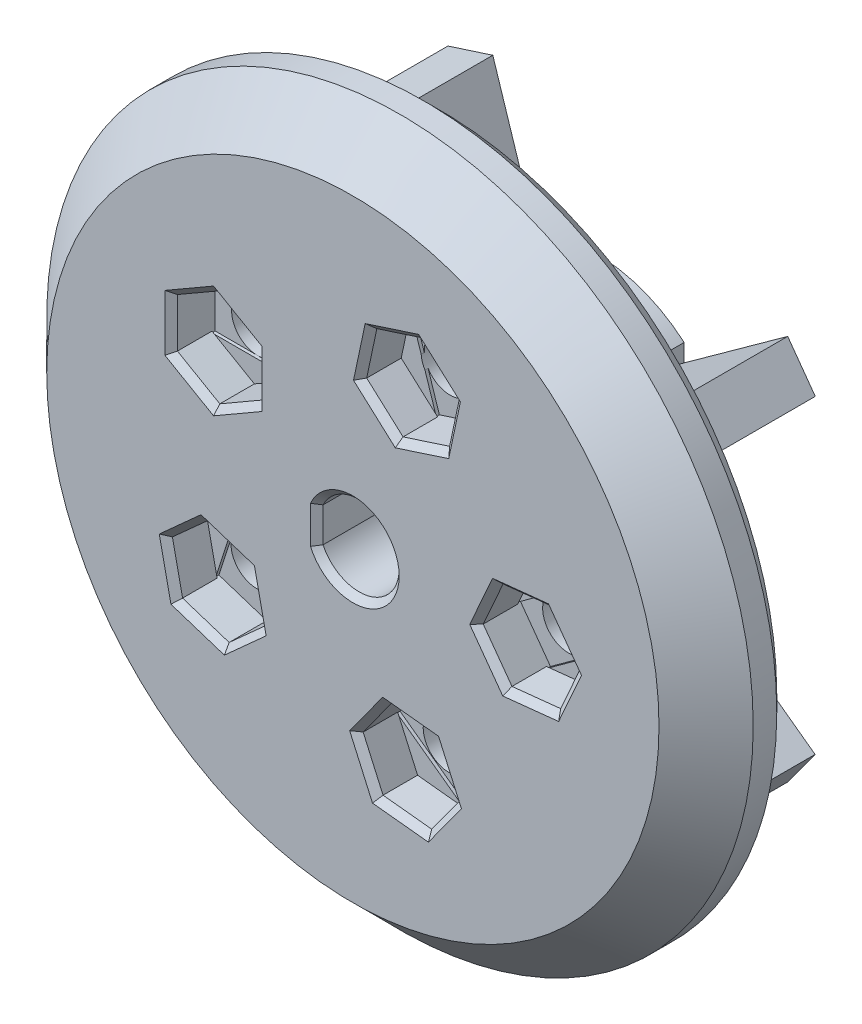
from build123d import *
from build123d.topology import SkipClean

# Parameters (mm, degrees)
SKETCH1_R               = 22.5
BOSS_EXTRUDE1_DEPTH     = 5.5
SKETCH2_R               = 1.524999999999999
SKETCH2_R_2             = 1.5250000000000004
SKETCH2_R_3             = 1.5250000000000008
CUT_EXTRUDE1_DEPTH      = 3.5
CUT_EXTRUDE2_DEPTH      = 33.29163978493505
CUT_EXTRUDE2_DEPTH_BACK = 33.29163978493505
SKETCH3_R               = 2.5500000000000003
SKETCH3_R_2             = 1.6500000000000006
SKETCH3_R_3             = 1.6500000000000001
SKETCH3_R_4             = 1.6500000000000004
BOSS_EXTRUDE2_START     = 10
SKETCH4_R               = 8.550000000000002
SKETCH4_R_2             = 2.5500000000000003
BOSS_EXTRUDE2_DEPTH     = 10
BOSS_EXTRUDE3_DEPTH     = 15.5
CUT_EXTRUDE3_DEPTH      = 10
SKETCH5_R               = 1.5000000000000004
CUT_EXTRUDE4_DEPTH      = 8
CHAMFER7_SIZE           = 1
CHAMFER8_SIZE           = 3
CUT_EXTRUDE5_DEPTH      = 2.2
CORTAR_EXTRUIR1_DEPTH   = 2.6
CROQUIS2_W              = 5.399999999999998
CROQUIS2_H              = 3.3
CORTAR_EXTRUIR2_DEPTH   = 0.2
MATRIZC1_COUNT          = 5
CHAFL_N1_SIZE           = 0.4
SALIENTE_EXTRUIR1_REACH = 35.354
CORTAR_EXTRUIR3_DEPTH   = 7.8
SALIENTE_EXTRUIR2_START = -2.2
SALIENTE_EXTRUIR2_DEPTH = 7.8
REDONDEO1_R             = 7
CORTAR_EXTRUIR4_START   = -30.200000000000003
CROQUIS6_R              = 1.5000000000000004
CORTAR_EXTRUIR4_DEPTH   = 30.200000000000003
CHAFL_N2_SIZE           = 0.4


with BuildPart() as part:
    # Sketch1 → Boss-Extrude1 (new body)
    with BuildSketch(Plane.XY):
        Circle(SKETCH1_R)
        with BuildLine():
            ThreePointArc((-1.7397196261682235, -1.8643700336373934), (2.55, 0), (-1.7397196261682235, 1.8643700336373934))
            ThreePointArc((-1.7397196261682235, 1.8643700336373934), (-2.55, 3.1e-16), (-1.7397196261682235, -1.8643700336373934))
        make_face(mode=Mode.SUBTRACT)
    extrude(amount=BOSS_EXTRUDE1_DEPTH)

    # Sketch2 → Cut-Extrude1 (cut)
    with BuildSketch(Plane(origin=(0, 0, 0), x_dir=(-1, 0, 0), z_dir=(0, 0, -1))):
        with Locations((-18.850000000000005, -2.51e-15)):
            Circle(SKETCH2_R)
        with Locations((-5.824970343967765, 17.92741533216365)):
            Circle(SKETCH2_R_2)
        with Locations((15.24997034396776, 11.079752005713127)):
            Circle(SKETCH2_R_3)
        with Locations((15.249970343967767, -11.079752005713122)):
            Circle(SKETCH2_R_3)
        with Locations((-5.824970343967754, -17.92741533216365)):
            Circle(SKETCH2_R_2)
    extrude(amount=-CUT_EXTRUDE1_DEPTH, mode=Mode.SUBTRACT)

    # Sketch3 → Cut-Extrude2 (cut, two sides: drawn at the far end of the back side and taken through both)
    with BuildSketch(Plane(origin=(0, 0, 0), x_dir=(-1, 0, 0), z_dir=(0, 0, -1)).offset(-CUT_EXTRUDE2_DEPTH_BACK)):
        with Locations(Location((0, 0, 0), (0, 0, 180))):
            Circle(SKETCH3_R)
        with Locations((-10.937500000000004, 0)):
            Circle(SKETCH3_R_2)
        with Locations((-3.3953242256948823, 10.449733472793108)):
            Circle(SKETCH3_R_3)
        with Locations((8.873623375975901, 6.50584328537859)):
            Circle(SKETCH3_R_2)
        with Locations((8.914074225694833, -6.381348371133892)):
            Circle(SKETCH3_R_2)
        with Locations((-3.329873375975839, -10.402180646978138)):
            Circle(SKETCH3_R_4)
    extrude(amount=CUT_EXTRUDE2_DEPTH + CUT_EXTRUDE2_DEPTH_BACK, mode=Mode.SUBTRACT)

    # Sketch4 → Boss-Extrude2 (add)
    with SkipClean():  # the faces are left unmerged after this step: merging them gives an invalid solid
        with BuildSketch(Plane(origin=(0, 0, 0), x_dir=(-1, 0, 0), z_dir=(0, 0, -1)).offset(BOSS_EXTRUDE2_START)):
            with Locations(Location((0, 0, 0), (0, 0, 180))):
                Circle(SKETCH4_R)
            Circle(SKETCH4_R_2, mode=Mode.SUBTRACT)
        extrude(amount=-BOSS_EXTRUDE2_DEPTH)

    # Sketch8 → Boss-Extrude3 (add)
    with BuildSketch(Plane(origin=(0, 0, -10), x_dir=(-1, 0, 0), z_dir=(0, 0, -1))):
        with BuildLine():
            Line((2.2999999999999994, 1.101135777277262), (2.2999999999999994, -1.101135777277262))
            ThreePointArc((2.2999999999999994, -1.101135777277262), (2.5499999999999994, 0), (2.2999999999999994, 1.101135777277262))
        make_face()
    extrude(amount=-BOSS_EXTRUDE3_DEPTH)

    # Sketch6 → Cut-Extrude3 (cut)
    with BuildSketch(Plane(origin=(0, 0, -10), x_dir=(-1, 0, 0), z_dir=(0, 0, -1))):
        Polygon((4.799999999999999, -2.8), (7.299999999999999, -2.8), (7.299999999999998, 2.8000000000000007), (4.799999999999998, 2.8), align=None)
    extrude(amount=-CUT_EXTRUDE3_DEPTH, mode=Mode.SUBTRACT)

    # Sketch5 → Cut-Extrude4 (cut)
    with BuildSketch(Plane.ZY.offset(8.55)):
        with Locations(Location((-4.2, -5.1e-16, 0), (0, 0, 47.230421849))):
            Circle(SKETCH5_R)
    extrude(amount=-CUT_EXTRUDE4_DEPTH, mode=Mode.SUBTRACT)

    # Chamfer7
    chamfer7_edges = [part.edges().sort_by_distance(p)[0] for p in [
        (-22.5, 2.76e-15, 0),
    ]]
    chamfer(chamfer7_edges, length=CHAMFER7_SIZE)

    # Chamfer8
    chamfer8_edges = [part.edges().sort_by_distance(p)[0] for p in [
        (-22.5, 2.76e-15, 5.5),
    ]]
    chamfer(chamfer8_edges, length=CHAMFER8_SIZE)

    # Sketch7 → Cut-Extrude5 (cut)
    with BuildSketch(Plane(origin=(0, 0, -10), x_dir=(-1, 0, 0), z_dir=(0, 0, -1))):
        with BuildLine():
            Line((-5.6, -6.460843598168895), (-5.6, 6.460843598168895))
            ThreePointArc((-5.6, 6.460843598168895), (-8.549999999999999, 1.05e-15), (-5.6, -6.460843598168895))
        make_face()
    extrude(amount=-CUT_EXTRUDE5_DEPTH, mode=Mode.SUBTRACT)

    # Croquis1 → Cortar-Extruir1 (cut)
    with BuildSketch(Plane.XY.offset(5.5)):
        Polygon((-8.873623375975903, 3.388151831754609), (-6.173623375975903, 4.9469975585666), (-6.173623375975902, 8.064689012190575), (-8.873623375975901, 9.623534739002565), (-11.5736233759759, 8.064689012190577), (-11.5736233759759, 4.946997558566598), align=None)
    cortar_extruir1 = extrude(amount=-CORTAR_EXTRUIR1_DEPTH, mode=Mode.SUBTRACT)

    # Croquis2 → Cortar-Extruir2 (cut)
    with BuildSketch(Plane.XY.offset(2.9)):
        with Locations((-8.873623375975901, 6.505843285378589)):
            Rectangle(CROQUIS2_W, CROQUIS2_H)
    cortar_extruir2 = extrude(amount=-CORTAR_EXTRUIR2_DEPTH, mode=Mode.SUBTRACT)

    # MatrizC1: Cortar-Extruir1, Cortar-Extruir2 ×5 about axis
    matrizc1_axis = Axis((-2e-17, -3.9e-16, 0), (0, 0, 1))
    add([cortar_extruir1.rotate(matrizc1_axis, i * 360 / MATRIZC1_COUNT) for i in range(1, MATRIZC1_COUNT)], mode=Mode.SUBTRACT)
    add([cortar_extruir2.rotate(matrizc1_axis, i * 360 / MATRIZC1_COUNT) for i in range(1, MATRIZC1_COUNT)], mode=Mode.SUBTRACT)

    # Chaflán1
    chafl_n1_edges = [part.edges().sort_by_distance(p)[0] for p in [
        (2.5056715353681804, -0.47340274275258587, 5.5),
        (-2.2999999999999994, 0, 5.5),
    ]]
    chamfer(chafl_n1_edges, length=CHAFL_N1_SIZE)

    # Saliente-Extruir1: up to this face of the body (flat: up to its plane)
    saliente_extruir1_end = Plane(part.part.faces().sort_by_distance((6.799398496, 0, -7.8))[0])
    # Croquis3 → Saliente-Extruir1 (add, up to the picked face)
    with BuildSketch(Plane(origin=(0, 0, 0), x_dir=(-1, 0, 0), z_dir=(0, 0, -1)), mode=Mode.PRIVATE) as saliente_extruir1_sk1:
        with BuildLine():
            Line((-5.916317910755698, 6.172494016106563), (-14.397127268923029, 12.293583616545227))
            Line((-14.397127268923029, 12.293583616545227), (-16.15285624889486, 9.861009722726777))
            Line((-16.15285624889486, 9.861009722726777), (-7.684338630479848, 3.7487917803093715))
            ThreePointArc((-7.684338630479848, 3.7487917803093715), (-6.9074631899211285, 5.038794724920297), (-5.916317910755698, 6.172494016106563))
        make_face()
    saliente_extruir1_tool1 = split(extrude(saliente_extruir1_sk1.sketch, amount=SALIENTE_EXTRUIR1_REACH, mode=Mode.PRIVATE), bisect_by=saliente_extruir1_end, keep=Keep.BOTH, mode=Mode.PRIVATE)
    # Croquis3 → Saliente-Extruir1 (add, up to the picked face)
    with BuildSketch(Plane(origin=(0, 0, 0), x_dir=(-1, 0, 0), z_dir=(0, 0, -1)), mode=Mode.PRIVATE) as saliente_extruir1_sk2:
        with BuildLine():
            Line((4.042147877262594, 7.534158250152536), (7.242935810858491, 17.4914079643218))
            Line((7.242935810858491, 17.4914079643218), (4.386870465445089, 18.409498778309516))
            Line((4.386870465445089, 18.409498778309516), (1.190721623546755, 8.466680696425149))
            ThreePointArc((1.190721623546755, 8.466680696425149), (2.6576550437040805, 8.126461079010609), (4.042147877262594, 7.534158250152536))
        make_face()
    saliente_extruir1_tool2 = split(extrude(saliente_extruir1_sk2.sketch, amount=SALIENTE_EXTRUIR1_REACH, mode=Mode.PRIVATE), bisect_by=saliente_extruir1_end, keep=Keep.BOTH, mode=Mode.PRIVATE)
    # Croquis3 → Saliente-Extruir1 (add, up to the picked face)
    with BuildSketch(Plane(origin=(0, 0, 0), x_dir=(-1, 0, 0), z_dir=(0, 0, -1)), mode=Mode.PRIVATE) as saliente_extruir1_sk3:
        with BuildLine():
            Line((8.41450268645722, -1.5161281408918625), (18.873507778367358, -1.4832989835037467))
            Line((18.873507778367358, -1.4832989835037467), (18.864091300783, 1.5166862381181687))
            Line((18.864091300783, 1.5166862381181687), (8.420245064971201, 1.4839046619740013))
            ThreePointArc((8.420245064971201, 1.4839046619740013), (8.54998433730284, -0.01636556983859468), (8.41450268645722, -1.5161281408918625))
        make_face()
    saliente_extruir1_tool3 = split(extrude(saliente_extruir1_sk3.sketch, amount=SALIENTE_EXTRUIR1_REACH, mode=Mode.PRIVATE), bisect_by=saliente_extruir1_end, keep=Keep.BOTH, mode=Mode.PRIVATE)
    # Croquis3 → Saliente-Extruir1 (add, up to the picked face)
    with BuildSketch(Plane(origin=(0, 0, 0), x_dir=(-1, 0, 0), z_dir=(0, 0, -1)), mode=Mode.PRIVATE) as saliente_extruir1_sk4:
        with BuildLine():
            Line((1.1583007813952673, -8.471176972523898), (4.421533483108055, -18.408137151605285))
            Line((4.421533483108055, -18.408137151605285), (7.271779125320021, -17.47213513288327))
            Line((7.271779125320021, -17.47213513288327), (4.013276020209014, -7.549577179260792))
            ThreePointArc((4.013276020209014, -7.549577179260792), (2.626525880028321, -8.136575557416123), (1.1583007813952673, -8.471176972523898))
        make_face()
    saliente_extruir1_tool4 = split(extrude(saliente_extruir1_sk4.sketch, amount=SALIENTE_EXTRUIR1_REACH, mode=Mode.PRIVATE), bisect_by=saliente_extruir1_end, keep=Keep.BOTH, mode=Mode.PRIVATE)
    # Croquis3 → Saliente-Extruir1 (add, up to the picked face)
    with BuildSketch(Plane(origin=(0, 0, 0), x_dir=(-1, 0, 0), z_dir=(0, 0, -1)), mode=Mode.PRIVATE) as saliente_extruir1_sk5:
        with BuildLine():
            Line((-7.698633434359383, -3.7193471528433393), (-16.14084980341087, -9.893555445757995))
            Line((-16.14084980341087, -9.893555445757995), (-14.369884642653243, -12.315059606271191))
            Line((-14.369884642653243, -12.315059606271191), (-5.93990407824712, -6.149799959447728))
            ThreePointArc((-5.93990407824712, -6.149799959447728), (-6.926702071114108, -5.012314676676189), (-7.698633434359383, -3.7193471528433393))
        make_face()
    saliente_extruir1_tool5 = split(extrude(saliente_extruir1_sk5.sketch, amount=SALIENTE_EXTRUIR1_REACH, mode=Mode.PRIVATE), bisect_by=saliente_extruir1_end, keep=Keep.BOTH, mode=Mode.PRIVATE)
    add(saliente_extruir1_tool1.solids().sort_by(Axis((11.073285, 8.04513, 0), (0, 0, -1)))[0])
    add(saliente_extruir1_tool2.solids().sort_by(Axis((-4.229541, 13.017402, 0), (0, 0, -1)))[0])
    add(saliente_extruir1_tool3.solids().sort_by(Axis((-13.687285, 6.6e-05, 0), (0, 0, -1)))[0])
    add(saliente_extruir1_tool4.solids().sort_by(Axis((-4.229667, -13.017361, 0), (0, 0, -1)))[0])
    add(saliente_extruir1_tool5.solids().sort_by(Axis((11.073207, -8.045238, 0), (0, 0, -1)))[0])

    # Croquis4 → Cortar-Extruir3 (cut)
    with SkipClean():  # the faces are left unmerged after this step: merging them gives an invalid solid
        with BuildSketch(Plane(origin=(0, 0, -7.8), x_dir=(-1, 0, 0), z_dir=(0, 0, -1))):
            with BuildLine():
                Line((8.414502686457222, -1.5161281408918632), (18.87350777836736, -1.4832989835037467))
                Line((18.87350777836736, -1.4832989835037467), (18.864091300783, 1.5166862381181687))
                Line((18.864091300783, 1.5166862381181687), (8.420245064971198, 1.4839046619740017))
                ThreePointArc((8.420245064971198, 1.4839046619740017), (8.549984337302842, -0.01636556983859421), (8.414502686457222, -1.5161281408918632))
            make_face()
        extrude(amount=-CORTAR_EXTRUIR3_DEPTH, mode=Mode.SUBTRACT)

    # Croquis5 → Saliente-Extruir2 (add)
    with SkipClean():  # the faces are left unmerged after this step: merging them gives an invalid solid
        with BuildSketch(Plane(origin=(0, 0, -10), x_dir=(-1, 0, 0), z_dir=(0, 0, -1)).offset(SALIENTE_EXTRUIR2_START)):
            with BuildLine():
                Line((7.55661961461605, 4.000000000000001), (12.55661961461605, 4))
                Line((12.55661961461605, 4), (12.55661961461605, -4))
                Line((12.55661961461605, -4), (7.55661961461605, -4.000000000000001))
                ThreePointArc((7.55661961461605, -4.000000000000001), (8.550000000000002, 0), (7.55661961461605, 4.000000000000001))
            make_face()
        extrude(amount=-SALIENTE_EXTRUIR2_DEPTH)

    # Redondeo1
    redondeo1_edges = [part.edges().sort_by_distance(p)[0] for p in [
        (-7.556619614616052, 4.000000000000002, -3.9),
        (-7.556619614616052, -4.000000000000002, -3.9),
    ]]
    fillet(redondeo1_edges, radius=REDONDEO1_R)

    # Croquis6 → Cortar-Extruir4 (cut)
    with SkipClean():  # the faces are left unmerged after this step: merging them gives an invalid solid
        with BuildSketch(Plane(origin=(-7.299999999999999, 1.13e-15, 0), x_dir=(0, 0, -1), z_dir=(1, -1.5e-16, 0)).offset(CORTAR_EXTRUIR4_START)):
            with Locations(Location((4.2, -1.65e-15, 0), (0, 0, 132.769578151))):
                Circle(CROQUIS6_R)
        extrude(amount=CORTAR_EXTRUIR4_DEPTH, mode=Mode.SUBTRACT)

    # Chaflán2
    chafl_n2_edges = [part.edges().sort_by_distance(p)[0] for p in [
        (-10.223623375975901, 4.167574695160603, 5.5),
        (-7.5236233759759035, 4.167574695160605, 5.5),
        (-6.173623375975902, 6.505843285378587, 5.5),
        (-7.523623375975902, 8.844111875596571, 5.5),
        (-10.223623375975901, 8.844111875596571, 5.5),
        (-11.5736233759759, 6.505843285378587, 5.5),
        (-7.122872438244806, -8.43539222573772, 5.5),
        (-6.288526553432449, -5.867539631740807, 5.5),
        (-8.095179190601366, -3.861048602951842, 5.5),
        (-10.73617771258264, -4.422410168159791, 5.5),
        (-11.570523597394999, -6.990262762156705, 5.5),
        (-9.76387096022608, -8.99675379094567, 5.5),
        (5.821446111610776, -9.380933799103142, 5.5),
        (3.6371002267984167, -7.793913617913467, 5.5),
        (1.170527491163394, -8.892102554218123, 5.5),
        (0.8883006403407296, -11.577311671712462, 5.5),
        (3.0726465251530874, -13.164331852902139, 5.5),
        (5.5392192607881094, -12.066142916597478, 5.5),
        (10.72072399889618, 2.6376562916792996, 5.5),
        (8.536378114083822, 1.050636110489623, 5.5),
        (8.818604964906484, -1.634573007004714, 5.5),
        (11.285177700541507, -2.7327619433093746, 5.5),
        (13.469523585353866, -1.145741762119698, 5.5),
        (13.1872967345312, 1.5394673553746394, 5.5),
        (0.8043257037137564, 11.011095038000954, 5.5),
        (1.638671588526115, 8.443242444004042, 5.5),
        (4.2796701105073875, 7.88188087879609, 5.5),
        (6.086322747676306, 9.888371907585054, 5.5),
        (5.251976862863948, 12.456224501581968, 5.5),
        (2.6109783408826734, 13.017586066789917, 5.5),
    ]]
    chamfer(chafl_n2_edges, length=CHAFL_N2_SIZE)


solid = part.part
